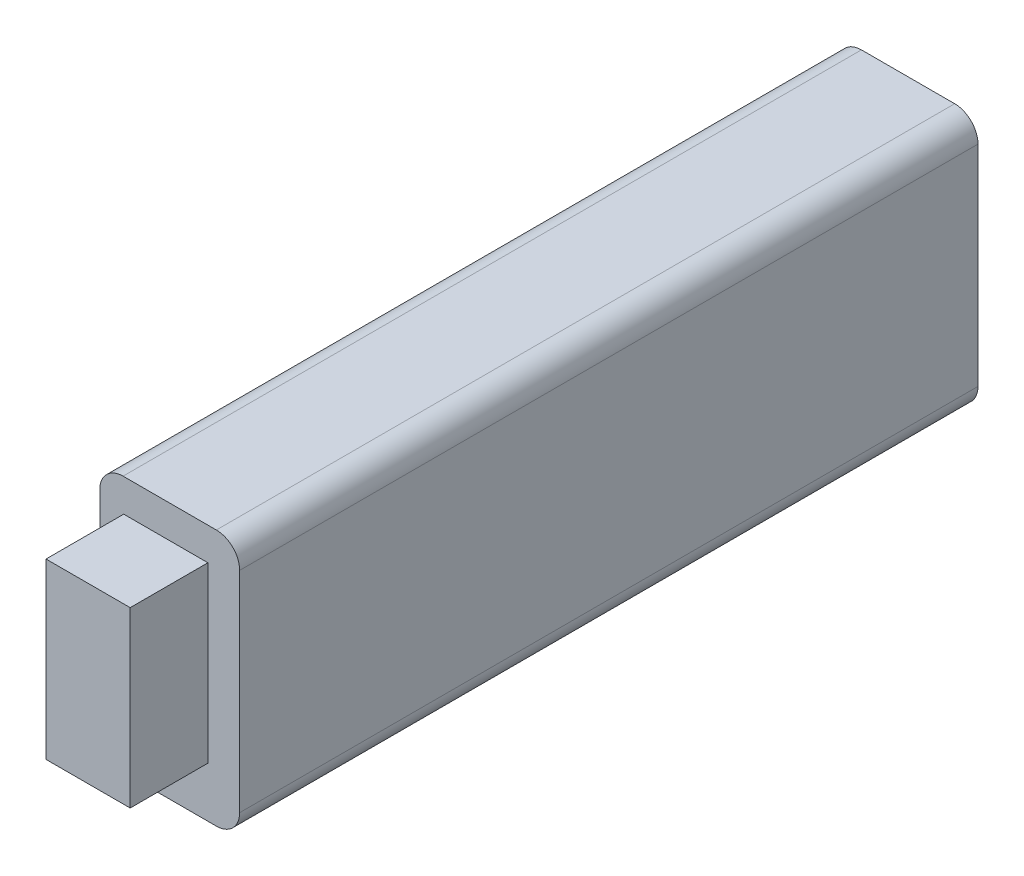
from build123d import *

# Parameters (mm, degrees)
SKETCH1_W           = 95
SKETCH1_H           = 33
BOSS_EXTRUDE1_DEPTH = 18
SKETCH2_W           = 10.831848702
SKETCH2_H           = 22.331730537
BOSS_EXTRUDE2_DEPTH = 10
FILLET1_R           = 3


with BuildPart() as part:
    # Sketch1 → Boss-Extrude1 (new body)
    with BuildSketch(Plane(origin=(0, 0, 0), x_dir=(0, 0, -1), z_dir=(1, 0, 0))):
        Rectangle(SKETCH1_W, SKETCH1_H)
    extrude(amount=BOSS_EXTRUDE1_DEPTH)

    # Sketch2 → Boss-Extrude2 (add)
    with BuildSketch(Plane.XY.offset(47.5)):
        with Locations((8.498326505, 1.139612194)):
            Rectangle(SKETCH2_W, SKETCH2_H)
    extrude(amount=BOSS_EXTRUDE2_DEPTH)

    # Fillet1
    fillet1_edges = [part.edges().sort_by_distance(p)[0] for p in [
        (18, -16.5, 0),
        (0, -16.5, 0),
        (0, 16.5, 0),
        (18, 16.5, 0),
    ]]
    fillet(fillet1_edges, radius=FILLET1_R)


solid = part.part
